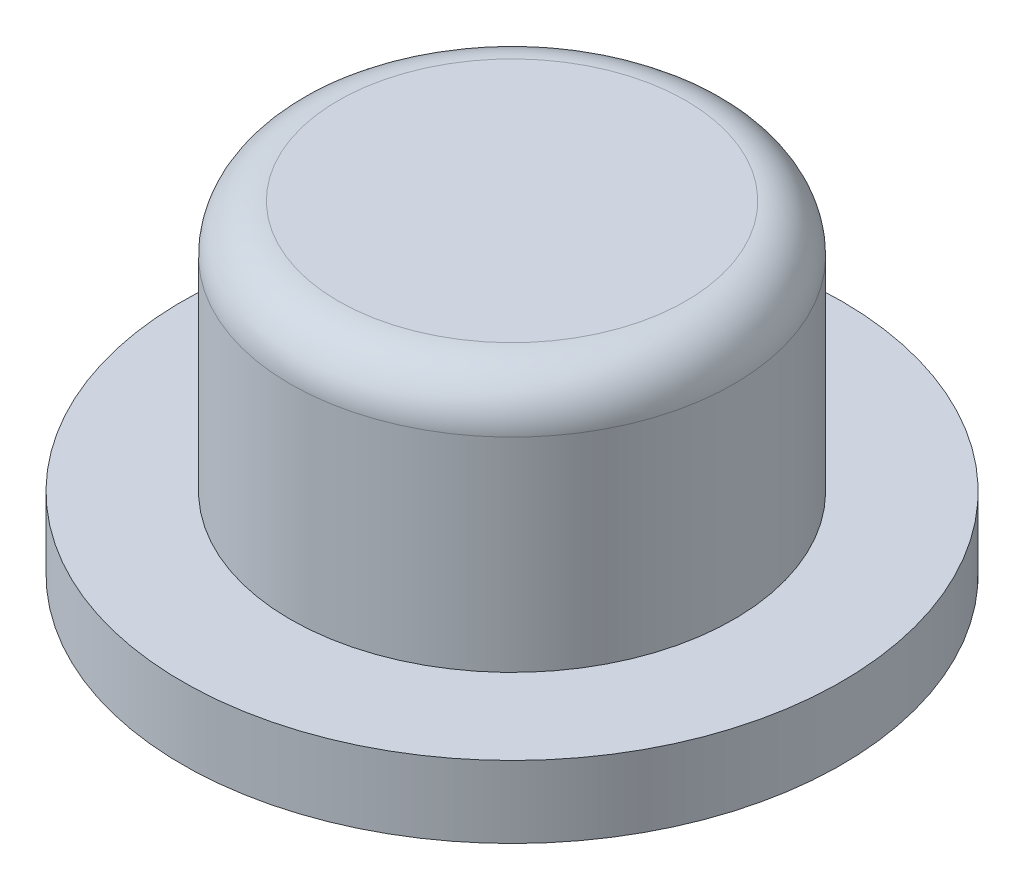
from build123d import *

# Parameters (mm, degrees)
SKETCH1_R           = 3.4925
BOSS_EXTRUDE1_DEPTH = 0.762
SKETCH2_R           = 2.3495
BOSS_EXTRUDE2_DEPTH = 2.667
FILLET1_R           = 0.508


with BuildPart() as part:
    # Sketch1 → Boss-Extrude1 (new body)
    with BuildSketch(Plane(origin=(0, 0, 0), x_dir=(1, 0, 0), z_dir=(0, 1, 0))):
        with Locations(Location((0, 0, 0), (0, 0, 90))):
            Circle(SKETCH1_R)
    extrude(amount=BOSS_EXTRUDE1_DEPTH)

    # Sketch2 → Boss-Extrude2 (add)
    with BuildSketch(Plane(origin=(0, 0.762, 0), x_dir=(1, 0, 0), z_dir=(0, 1, 0))):
        with Locations(Location((0, 0, 0), (0, 0, 270))):
            Circle(SKETCH2_R)
    extrude(amount=BOSS_EXTRUDE2_DEPTH)

    # Fillet1
    fillet1_edges = [part.edges().sort_by_distance(p)[0] for p in [
        (0, 3.429, -2.3495),
    ]]
    fillet(fillet1_edges, radius=FILLET1_R)


solid = part.part
